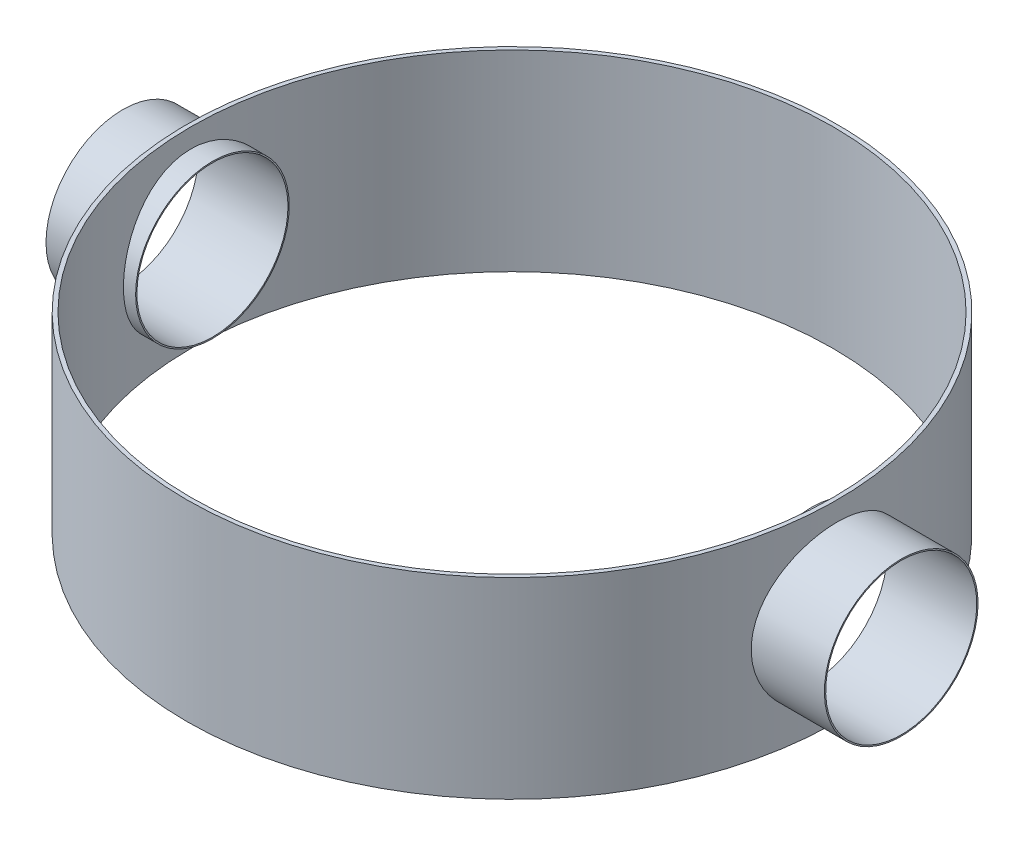
from build123d import *

# Parameters (mm, degrees)
SCHIZZO2_R                  = 254
SCHIZZO2_R_2                = 250.8
ESTRUSIONE_SOTTILE1_DEPTH   = 75
SWEEP_SOTTILE2_PROFILE_R    = 60
SWEEP_SOTTILE2_PROFILE_R_2  = 59
TAGLIO_ESTRUSIONE1_REACH    = 619.661
SCHIZZO26_R                 = 59
RIPETIZIONECIRCOLARE1_COUNT = 2


with BuildPart() as part:
    # Schizzo2 → Estrusione-Sottile1 (new, symmetric)
    with BuildSketch(Plane(origin=(0, 0, 0), x_dir=(1, 0, 0), z_dir=(0, 1, 0))):
        Circle(SCHIZZO2_R)
        Circle(SCHIZZO2_R_2, mode=Mode.SUBTRACT)
    extrude(amount=ESTRUSIONE_SOTTILE1_DEPTH, both=True)

    # Sweep-Sottile2: sweep along a path in Schizzo3
    with BuildLine(Plane.XY) as sweep_sottile2_path:
        Line((234, 0), (304, 0))
    # Sweep-Sottile2 profile (on start of the path) → Sweep-Sottile2 (sweep)
    with BuildSketch(Plane.YZ.offset(234)):
        Circle(SWEEP_SOTTILE2_PROFILE_R)
        Circle(SWEEP_SOTTILE2_PROFILE_R_2, mode=Mode.SUBTRACT)
    sweep_sottile2 = sweep(path=sweep_sottile2_path.line)

    # Schizzo26 → Taglio-Estrusione1 (cut, up to next)
    with BuildSketch(Plane(origin=(304, 0, 0), x_dir=(0, 0, -1), z_dir=(1, 0, 0)), mode=Mode.PRIVATE) as taglio_estrusione1_sk1:
        with Locations(Location((0, 0, 0), (0, 0, 90))):
            Circle(SCHIZZO26_R)
    taglio_estrusione1_tool1 = extrude(taglio_estrusione1_sk1.sketch, amount=-TAGLIO_ESTRUSIONE1_REACH, mode=Mode.PRIVATE) & part.part
    add(taglio_estrusione1_tool1.solids().sort_by_distance((304, 0, 0))[0], mode=Mode.SUBTRACT)
    add(taglio_estrusione1_tool1.solids().sort_by_distance((304, 0, 0))[1], mode=Mode.SUBTRACT)

    # RipetizioneCircolare1: Sweep-Sottile2 ×2 about axis
    ripetizionecircolare1_axis = Axis((0, 75, 0), (0, 1, 0))
    for i in range(1, RIPETIZIONECIRCOLARE1_COUNT):
        add(sweep_sottile2.rotate(ripetizionecircolare1_axis, i * 360 / RIPETIZIONECIRCOLARE1_COUNT))


solid = part.part
